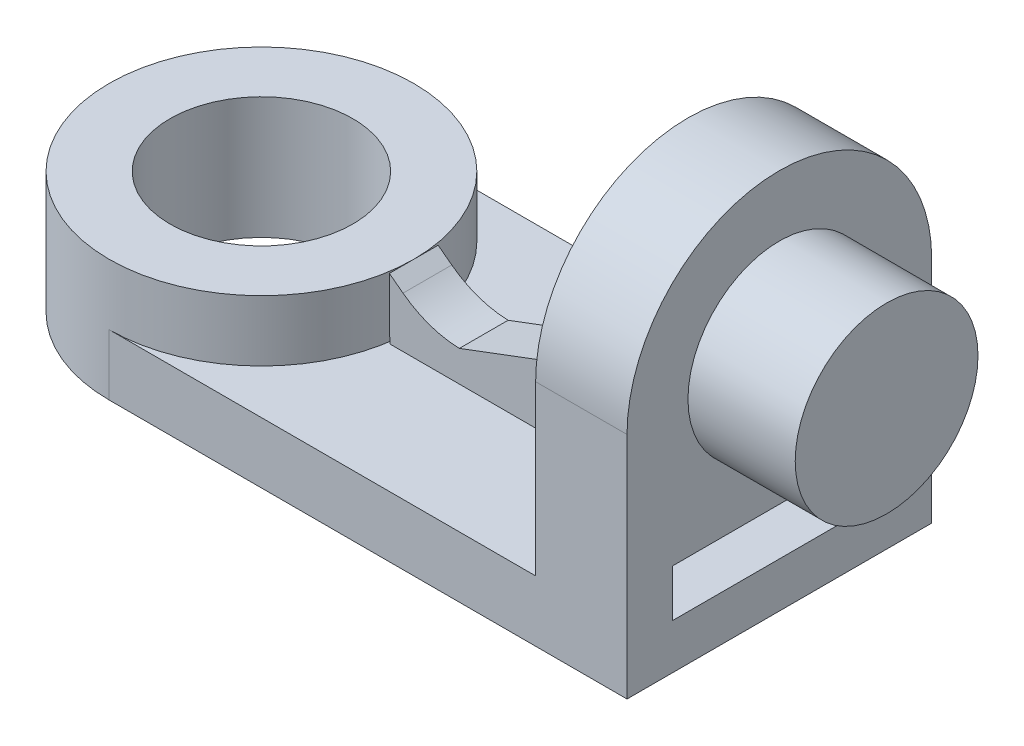
from build123d import *

# Parameters (mm, degrees)
SKETCH1_W                 = 53.975
SKETCH1_H                 = 31.75
BOSS_EXTRUDE1_DEPTH       = 6.35
SKETCH2_R                 = 15.875
BOSS_EXTRUDE2_DEPTH       = 12.7
SKETCH3_R                 = 9.525
CUT_EXTRUDE1_DEPTH        = 12.7
SKETCH4_W                 = 9.525
SKETCH4_H                 = 31.75
BOSS_EXTRUDE4_DEPTH       = 17.526
SKETCH6_R                 = 15.875
BOSS_EXTRUDE5_DEPTH       = 9.525
SKETCH7_R                 = 9.525
BOSS_EXTRUDE6_DEPTH       = 11.176
BOSS_EXTRUDE11_DEPTH      = 2.54
BOSS_EXTRUDE11_DEPTH_BACK = 2.54
SKETCH10_W                = 22.24003272
SKETCH10_H                = 4.930670522
CUT_EXTRUDE2_DEPTH        = 7.62


with BuildPart() as part:
    # Sketch1 → Boss-Extrude1 (new body)
    with BuildSketch(Plane(origin=(0, 0, 0), x_dir=(1, 0, 0), z_dir=(0, 1, 0))):
        with Locations((26.9875, -15.875)):
            Rectangle(SKETCH1_W, SKETCH1_H)
    extrude(amount=BOSS_EXTRUDE1_DEPTH)

    # Sketch2 → Boss-Extrude2 (add)
    with BuildSketch(Plane(origin=(0, 0, 0), x_dir=(1, 0, 0), z_dir=(0, 1, 0))):
        with Locations(Location((0, -15.875, 0), (0, 0, 270))):
            Circle(SKETCH2_R)
    extrude(amount=BOSS_EXTRUDE2_DEPTH)

    # Sketch3 → Cut-Extrude1 (cut)
    with BuildSketch(Plane(origin=(0, 12.7, 0), x_dir=(1, 0, 0), z_dir=(0, 1, 0))):
        with Locations(Location((0, -15.875, 0), (0, 0, 270))):
            Circle(SKETCH3_R)
    extrude(amount=-CUT_EXTRUDE1_DEPTH, mode=Mode.SUBTRACT)

    # Sketch4 → Boss-Extrude4 (add)
    with BuildSketch(Plane(origin=(0, 6.35, 0), x_dir=(1, 0, 0), z_dir=(0, 1, 0))):
        with Locations((49.2125, -15.875)):
            Rectangle(SKETCH4_W, SKETCH4_H)
    extrude(amount=BOSS_EXTRUDE4_DEPTH)

    # Sketch6 → Boss-Extrude5 (add)
    with BuildSketch(Plane(origin=(53.975, 0, 0), x_dir=(0, 0, -1), z_dir=(1, 0, 0))):
        with Locations((-15.875, 23.876)):
            Circle(SKETCH6_R)
    extrude(amount=-BOSS_EXTRUDE5_DEPTH)

    # Sketch7 → Boss-Extrude6 (add)
    with BuildSketch(Plane(origin=(53.975, 0, 0), x_dir=(0, 0, -1), z_dir=(1, 0, 0))):
        with Locations(Location((-15.875, 23.876, 0), (0, 0, 180))):
            Circle(SKETCH7_R)
    extrude(amount=BOSS_EXTRUDE6_DEPTH)

    # Sketch10 → Cut-Extrude2 (cut)
    with BuildSketch(Plane(origin=(53.975, 0, 0), x_dir=(0, 0, -1), z_dir=(1, 0, 0))):
        with Locations((-15.875, 7.1755)):
            Rectangle(SKETCH10_W, SKETCH10_H)
    extrude(amount=-CUT_EXTRUDE2_DEPTH, mode=Mode.SUBTRACT)


with BuildPart() as body_2:
    # 3DSketch1 → Boss-Extrude11 (new, two sides: drawn at the far end of the back side and taken through both)
    with BuildSketch(Plane(origin=(15.946988355, 1.710649259, 15.875), x_dir=(0.8733587666153865, 0.4870774730738951, 0), z_dir=(0, 0, -1)).offset(-BOSS_EXTRUDE11_DEPTH_BACK)):
        with BuildLine():
            Line((0, 0), (24.954571984, 13.53182073))
            Line((24.954571984, 13.53182073), (32.501350351, 0))
            Line((32.501350351, 0), (10.139180944, -3.351635604))
            ThreePointArc((10.139180944, -3.351635604), (7.709103711, -5.353102519), (6.008377613, -8.002380894))
            Line((6.008377613, -8.002380894), (5.289793529, -9.632709715))
            Line((5.289793529, -9.632709715), (0, 0))
        make_face()
    extrude(amount=BOSS_EXTRUDE11_DEPTH + BOSS_EXTRUDE11_DEPTH_BACK)


solid = Compound([part.part, body_2.part])
